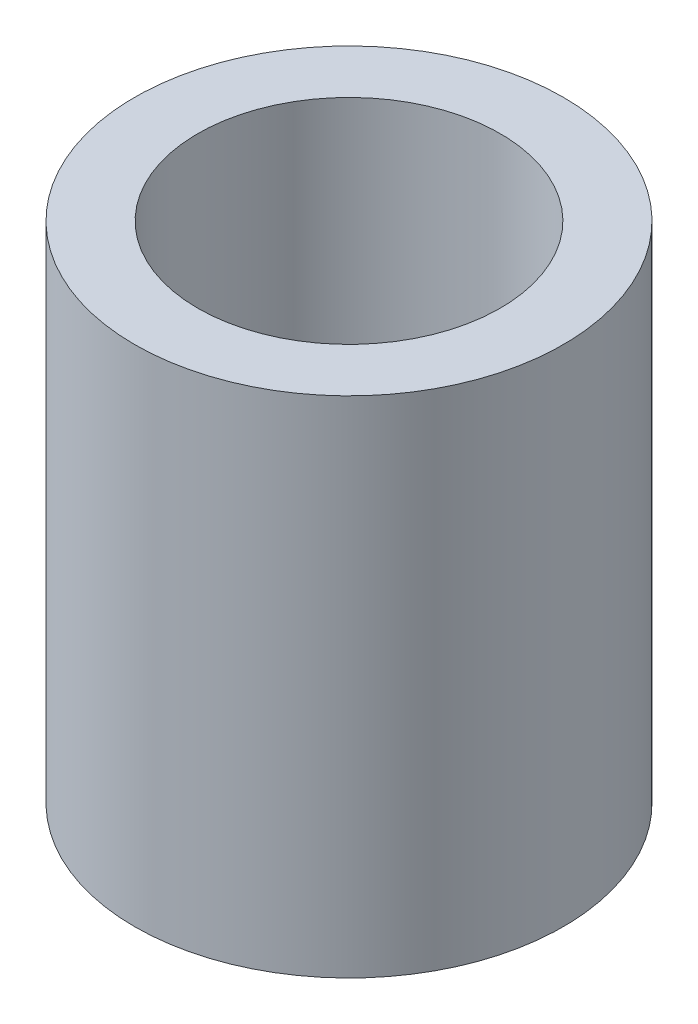
from build123d import *

# Parameters (mm, degrees)
SKETCH2_R           = 8.5
SKETCH2_R_2         = 6
BOSS_EXTRUDE1_DEPTH = 20


with BuildPart() as part:
    # Sketch2 → Boss-Extrude1 (new body)
    with BuildSketch(Plane(origin=(0, 0, 0), x_dir=(1, 0, 0), z_dir=(0, 1, 0))):
        with Locations(Location((0, 0, 0), (0, 0, 270))):
            Circle(SKETCH2_R)
        with Locations(Location((0, 0, 0), (0, 0, 270))):
            Circle(SKETCH2_R_2, mode=Mode.SUBTRACT)
    extrude(amount=BOSS_EXTRUDE1_DEPTH)


solid = part.part
